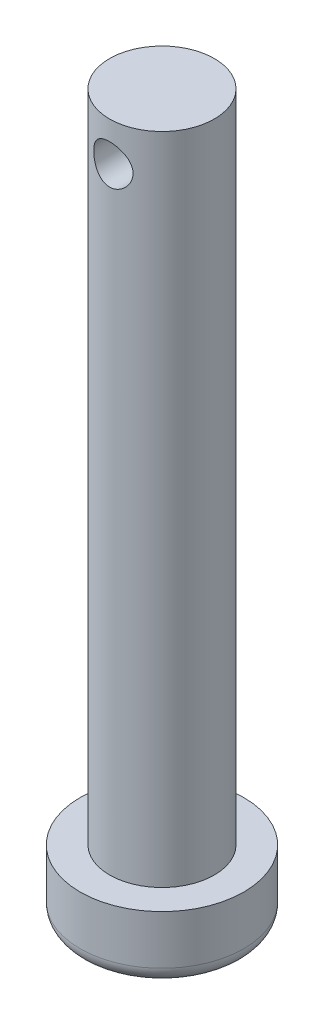
from build123d import *

# Parameters (mm, degrees)
SKETCH1_R           = 12.5
BOSS_EXTRUDE1_DEPTH = 10
FILLET1_R           = 2.5
SKETCH2_R           = 8
BOSS_EXTRUDE2_DEPTH = 100
SKETCH3_R           = 3
CUT_EXTRUDE1_DEPTH  = 50


with BuildPart() as part:
    # Sketch1 → Boss-Extrude1 (new body)
    with BuildSketch(Plane(origin=(0, 0, 0), x_dir=(1, 0, 0), z_dir=(0, 1, 0))):
        with Locations(Location((0, 0, 0), (0, 0, 270))):
            Circle(SKETCH1_R)
    extrude(amount=BOSS_EXTRUDE1_DEPTH)

    # Fillet1
    fillet1_edges = [part.edges().sort_by_distance(p)[0] for p in [
        (0, 0, -12.5),
    ]]
    fillet(fillet1_edges, radius=FILLET1_R)

    # Sketch2 → Boss-Extrude2 (add)
    with BuildSketch(Plane(origin=(0, 10, 0), x_dir=(1, 0, 0), z_dir=(0, 1, 0))):
        with Locations(Location((0, 0, 0), (0, 0, 270))):
            Circle(SKETCH2_R)
    extrude(amount=BOSS_EXTRUDE2_DEPTH)

    # Sketch3 → Cut-Extrude1 (cut, symmetric)
    with BuildSketch(Plane.XY):
        with Locations(Location((0, 104, 0), (0, 0, 90.000000025))):
            Circle(SKETCH3_R)
    extrude(amount=CUT_EXTRUDE1_DEPTH, both=True, mode=Mode.SUBTRACT)


solid = part.part
